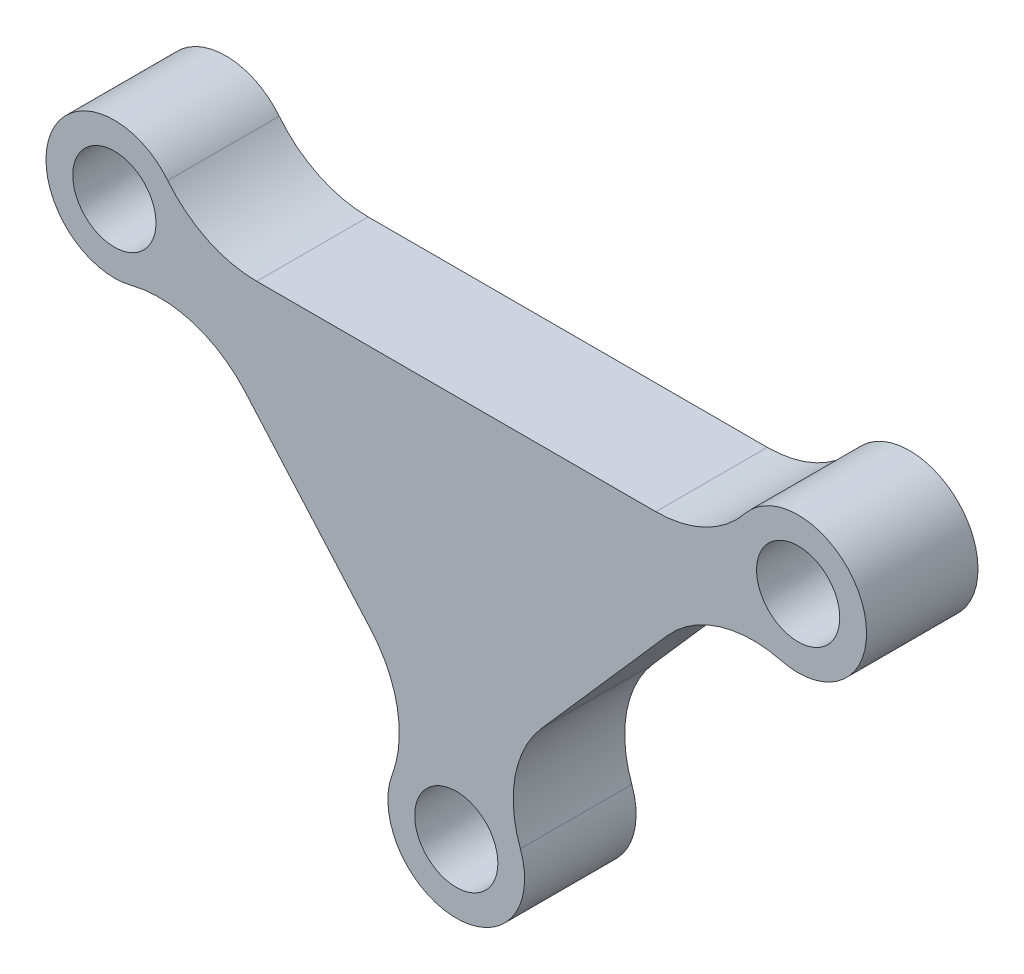
from build123d import *

# Parameters (mm, degrees)
ESQUISSE2_R        = 3
ESQUISSE2_R_2      = 1.825
BOSS_EXTRU_1_DEPTH = 4.89
CONG_1_R           = 5


with BuildPart() as part:
    # Esquisse2 → Boss.-Extru.1 (new body)
    # profile 1 of 4: a face of its own
    with BuildSketch(Plane.XY):
        with Locations((-15, 10)):
            Circle(ESQUISSE2_R)
        with Locations((-15, 10)):
            Circle(ESQUISSE2_R_2, mode=Mode.SUBTRACT)
    # profile 2 of 4: a face of its own
    with BuildSketch(Plane.XY):
        with Locations((15, 10)):
            Circle(ESQUISSE2_R)
        with Locations((15, 10)):
            Circle(ESQUISSE2_R_2, mode=Mode.SUBTRACT)
    # profile 3 of 4: a face of its own
    with BuildSketch(Plane.XY):
        with Locations((0, -6.825)):
            Circle(ESQUISSE2_R)
        with Locations((0, -6.825)):
            Circle(ESQUISSE2_R_2, mode=Mode.SUBTRACT)
    # profile 4 of 4: a face of its own
    with BuildSketch(Plane.XY):
        Polygon((-13.175, 10), (13.175, 10), (0, -5), align=None)
    extrude(amount=BOSS_EXTRU_1_DEPTH)

    # Congé1
    cong_1_edges = [part.edges().sort_by_distance(p)[0] for p in [
        (-12.208908932, 8.900086071, 2.445),
        (-12, 10, 2.445),
        (12, 10, 2.445),
        (12.208908932, 8.900086071, 2.445),
        (0.908352526, -3.965822551, 2.445),
        (-0.908352526, -3.965822551, 2.445),
    ]]
    fillet(cong_1_edges, radius=CONG_1_R)


solid = part.part
